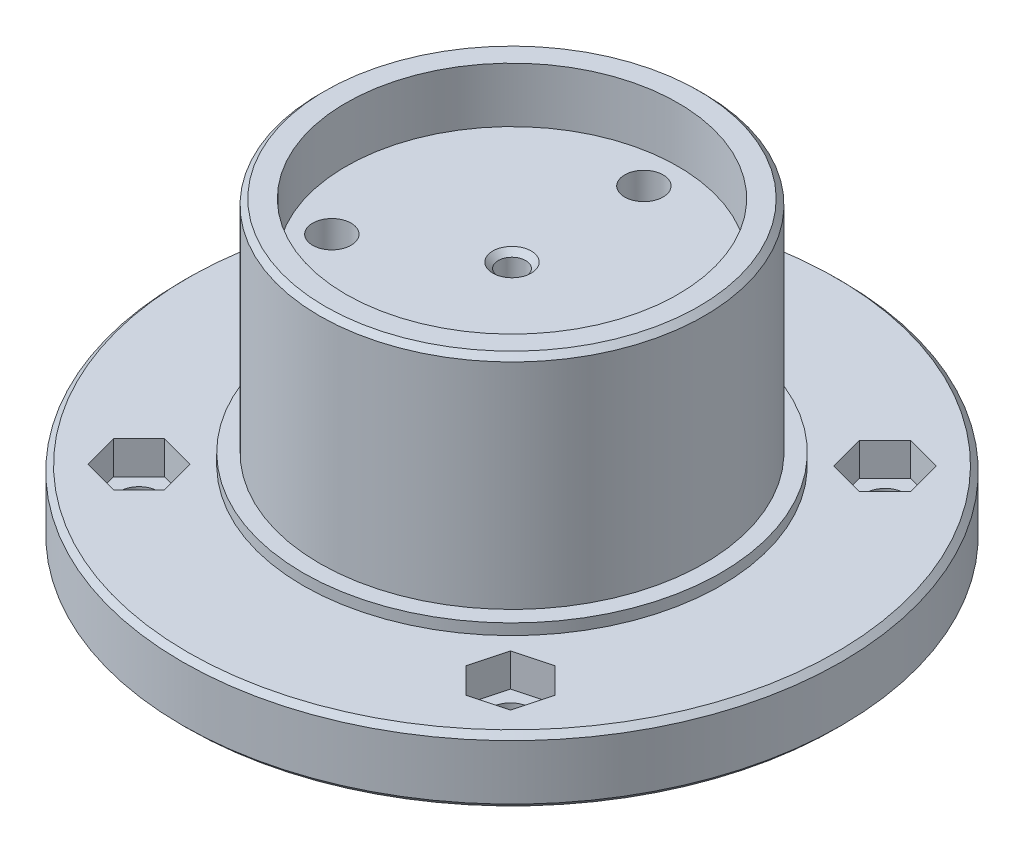
from build123d import *

# Parameters (mm, degrees)
SKETCH_1_R               = 30
EXTRUDE_1_DEPTH          = 6
EXTRUDE_START            = 6
SKETCH_3_R               = 19
EXTRUDE_2_DEPTH          = 1
EXTRUDE_START_2          = 7
SKETCH_4_R               = 17.5
EXTRUDE_3_DEPTH          = 20
SKETCH_5_R               = 15.1
CUT_EXTRUDE_1_DEPTH      = 5
SKETCH_6_R               = 1.75
CUT_EXTRUDE_2_DEPTH      = 51.289163843
PATTERN_CIRCULAR_1_COUNT = 3
SKETCH1_R                = 3.25
CUT_EXTRUDE1_DEPTH       = 14
CUT_EXTRUDE_3_DEPTH      = 51.289163843
CUT_EXTRUDE_3_DEPTH_BACK = 51.289163843
SKETCH_7_R               = 1.25
SKETCH_8_R               = 1.75
CUT_EXTRUDE_4_DEPTH      = 51.289163843
CUT_EXTRUDE_START        = 3
CUT_EXTRUDE_5_DEPTH      = 10
PATTERN_CIRCULAR_2_COUNT = 4
CHAMFER2_SIZE            = 0.5
CHAMFER1_SIZE            = 0.5


with BuildPart() as part:
    # Эскиз1 → Бобышка-Вытянуть1 (new body)
    with BuildSketch(Plane(origin=(0, 0, 0), x_dir=(1, 0, 0), z_dir=(0, 1, 0))):
        Circle(SKETCH_1_R)
    extrude(amount=EXTRUDE_1_DEPTH)

    # Эскиз3 → Бобышка-Вытянуть2 (add)
    with BuildSketch(Plane(origin=(0, 0, 0), x_dir=(1, 0, 0), z_dir=(0, 1, 0)).offset(EXTRUDE_START)):
        Circle(SKETCH_3_R)
    extrude(amount=EXTRUDE_2_DEPTH)

    # Эскиз4 → Бобышка-Вытянуть3 (add)
    with BuildSketch(Plane(origin=(0, 0, 0), x_dir=(1, 0, 0), z_dir=(0, 1, 0)).offset(EXTRUDE_START_2)):
        Circle(SKETCH_4_R)
    extrude(amount=EXTRUDE_3_DEPTH)

    # Эскиз5 → Вырез-Вытянуть1 (cut)
    with BuildSketch(Plane(origin=(0, 27, 0), x_dir=(1, 0, 0), z_dir=(0, 1, 0))):
        Circle(SKETCH_5_R)
    extrude(amount=-CUT_EXTRUDE_1_DEPTH, mode=Mode.SUBTRACT)

    # Эскиз6 → Вырез-Вытянуть2 (cut, through all)
    with BuildSketch(Plane(origin=(0, 0, 0), x_dir=(1, 0, 0), z_dir=(0, 1, 0))):
        with Locations((0, 12)):
            Circle(SKETCH_6_R)
    cut_extrude_2 = extrude(amount=CUT_EXTRUDE_2_DEPTH, mode=Mode.SUBTRACT)

    # Круговой массив1: Вырез-Вытянуть2 ×3 about axis
    pattern_circular_1_axis = Axis((0, 27, 0), (0, -1, 0))
    for i in range(1, PATTERN_CIRCULAR_1_COUNT):
        add(cut_extrude_2.rotate(pattern_circular_1_axis, i * 360 / PATTERN_CIRCULAR_1_COUNT), mode=Mode.SUBTRACT)

    # Sketch1 → Cut-Extrude1 (cut)
    with BuildSketch(Plane.XZ):
        with Locations((-10.392304845, 6)):
            Circle(SKETCH1_R)
        with Locations((10.392304845, 6)):
            Circle(SKETCH1_R)
        with Locations((0, -12)):
            Circle(SKETCH1_R)
    extrude(amount=-CUT_EXTRUDE1_DEPTH, mode=Mode.SUBTRACT)

    # Эскиз7 → Вырез-Вытянуть3 (cut, two sides: drawn at the far end of the back side and taken through both)
    with BuildSketch(Plane.XZ.offset(-CUT_EXTRUDE_3_DEPTH_BACK)):
        Circle(SKETCH_7_R)
    extrude(amount=CUT_EXTRUDE_3_DEPTH + CUT_EXTRUDE_3_DEPTH_BACK, mode=Mode.SUBTRACT)

    # Эскиз8 → Вырез-Вытянуть4 (cut, through all)
    with BuildSketch(Plane(origin=(0, 0, 0), x_dir=(1, 0, 0), z_dir=(0, 1, 0))):
        with Locations((17.039195094, 16.901651711)):
            Circle(SKETCH_8_R)
    cut_extrude_4 = extrude(amount=CUT_EXTRUDE_4_DEPTH, mode=Mode.SUBTRACT)

    # Эскиз8<3> → Вырез-Вытянуть5 (cut)
    with BuildSketch(Plane(origin=(0, 0, 0), x_dir=(1, 0, 0), z_dir=(0, 1, 0)).offset(CUT_EXTRUDE_START)):
        Polygon((14.712179838, 14.574636455), (17.890941793, 13.722889756), (20.217957048, 16.049905012), (19.36621035, 19.228666966), (16.187448396, 20.080413665), (13.86043314, 17.753398409), align=None)
    cut_extrude_5 = extrude(amount=CUT_EXTRUDE_5_DEPTH, mode=Mode.SUBTRACT)

    # Круговой массив2: Вырез-Вытянуть4, Вырез-Вытянуть5 ×4 about axis
    pattern_circular_2_axis = Axis((0, 6, 0), (0, -1, 0))
    add([cut_extrude_4.rotate(pattern_circular_2_axis, i * 360 / PATTERN_CIRCULAR_2_COUNT) for i in range(1, PATTERN_CIRCULAR_2_COUNT)], mode=Mode.SUBTRACT)
    add([cut_extrude_5.rotate(pattern_circular_2_axis, i * 360 / PATTERN_CIRCULAR_2_COUNT) for i in range(1, PATTERN_CIRCULAR_2_COUNT)], mode=Mode.SUBTRACT)

    # Chamfer2
    chamfer2_edges = [part.edges().sort_by_distance(p)[0] for p in [
        (-30, 0, 0),
        (-30, 6, 0),
    ]]
    chamfer(chamfer2_edges, length=CHAMFER2_SIZE)

    # Chamfer1
    chamfer1_edges = [part.edges().sort_by_distance(p)[0] for p in [
        (-17.5, 27, 0),
        (-1.25, 0, 0),
        (-1.25, 22, 0),
    ]]
    chamfer(chamfer1_edges, length=CHAMFER1_SIZE)


solid = part.part
